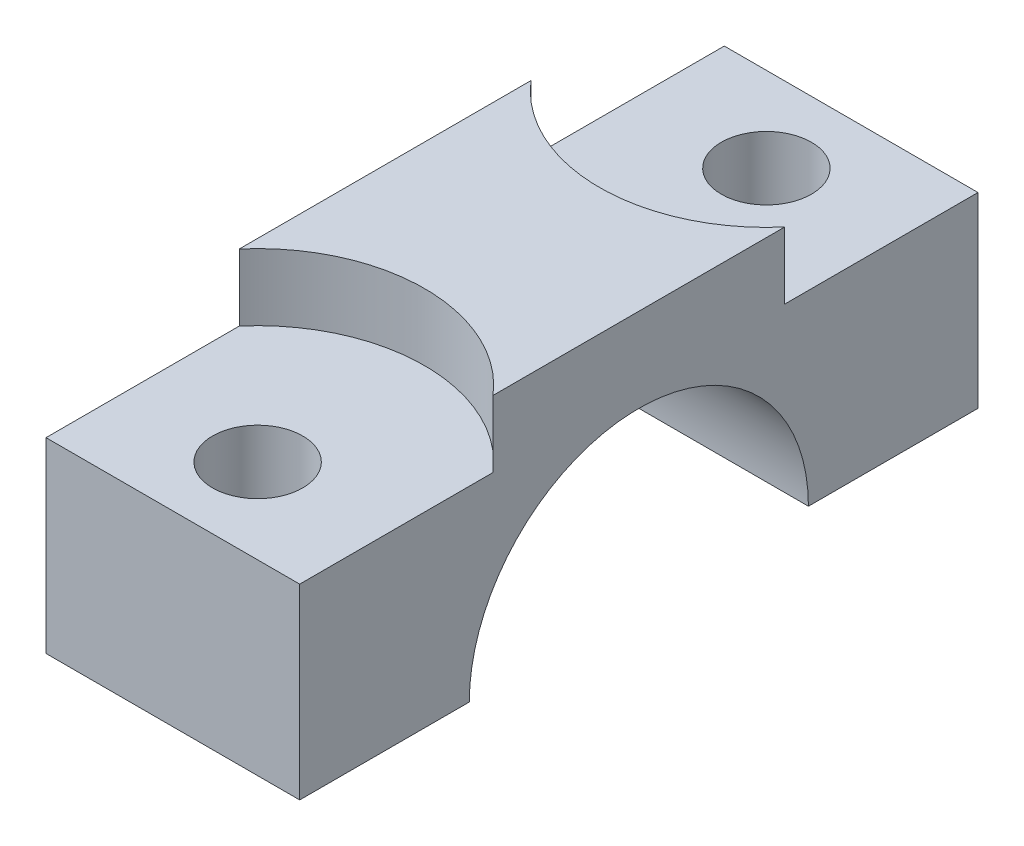
from build123d import *

# Parameters (mm, degrees)
BOSS_EXTRUDE1_DEPTH                           = 9.5
CBORE_FOR_M12_HEX_HEAD_CAP_SCREW2_D           = 6.75
CBORE_FOR_M12_HEX_HEAD_CAP_SCREW2_CBORE_D     = 25
CBORE_FOR_M12_HEX_HEAD_CAP_SCREW2_CBORE_DEPTH = 5


with BuildPart() as part:
    # Sketch1 → Boss-Extrude1 (new, symmetric)
    with BuildSketch(Plane(origin=(0, 0, 0), x_dir=(0, 0, -1), z_dir=(1, 0, 0))):
        with BuildLine():
            Line((25.4, 19), (-25.4, 19))
            Line((-25.4, 19), (-25.4, 0))
            Line((-25.4, 0), (-12.7, 0))
            ThreePointArc((-12.7, 0), (0, 12.7), (12.7, 0))
            Line((12.7, 0), (25.4, 0))
            Line((25.4, 0), (25.4, 19))
        make_face()
    extrude(amount=BOSS_EXTRUDE1_DEPTH, both=True)

    # CBORE for M12 Hex Head Cap Screw2 (through all)
    with Locations(Plane(origin=(0, 19, 0), x_dir=(1, 0, 0), z_dir=(0, 1, 0))):
        with Locations((0, 19.05), (0, -19.05)):
            CounterBoreHole(CBORE_FOR_M12_HEX_HEAD_CAP_SCREW2_D / 2, CBORE_FOR_M12_HEX_HEAD_CAP_SCREW2_CBORE_D / 2, CBORE_FOR_M12_HEX_HEAD_CAP_SCREW2_CBORE_DEPTH)


solid = part.part
